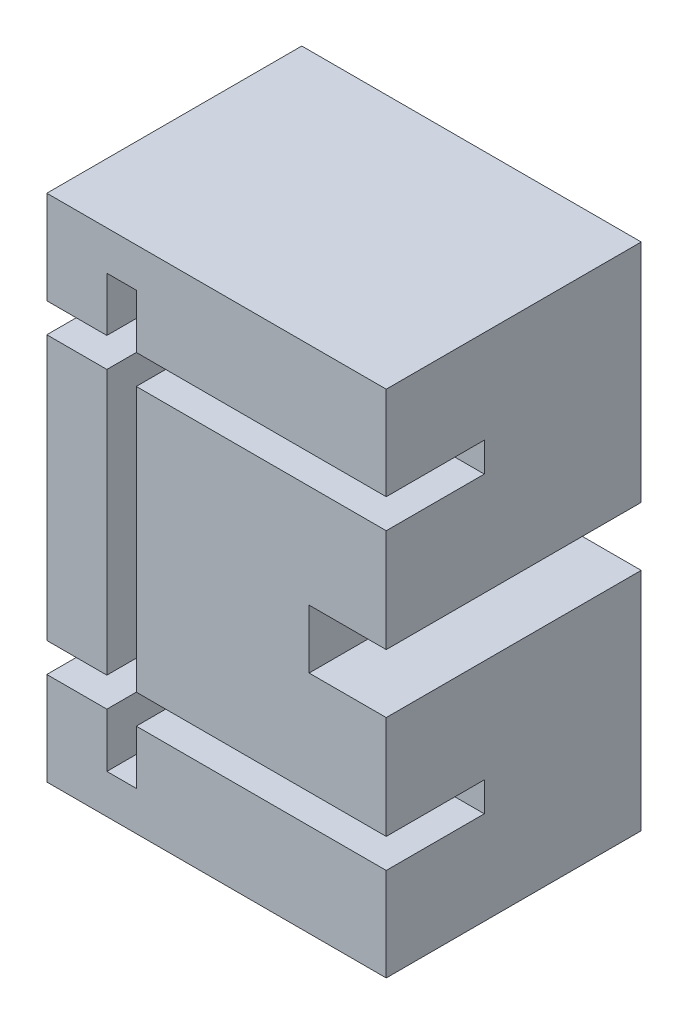
from build123d import *

# Parameters (mm, degrees)
BOSS_EXTRUDE1_DEPTH = 13
SKETCH2_W           = 12.743753884
SKETCH2_H           = 1.5
SKETCH2_W_2         = 1.5
SKETCH2_H_2         = 2.75
SKETCH2_W_3         = 3.0625
SKETCH2_H_3         = 13.5
CUT_EXTRUDE1_DEPTH  = 5


with BuildPart() as part:
    # Sketch1 → Boss-Extrude1 (new body)
    with BuildSketch(Plane.XY):
        Polygon((10.243753884, 1.5), (10.243753884, 13), (8.5625, 13), (7.0625, 13), (-7.0625, 13), (-7.0625, -13), (7.0625, -13), (8.5625, -13), (10.243753884, -13), (10.243753884, -1.5), (9.3125, -1.5), (6.3125, -1.5), (6.3125, 1.5), (9.3125, 1.5), align=None)
    extrude(amount=BOSS_EXTRUDE1_DEPTH)

    # Sketch2 → Cut-Extrude1 (cut)
    with BuildSketch(Plane.XY.offset(13)):
        with Locations((3.871876942, 7.5)):
            Rectangle(SKETCH2_W, SKETCH2_H)
        with Locations((-3.25, 9.625)):
            Rectangle(SKETCH2_W_2, SKETCH2_H_2)
        with Locations((-5.53125, 7.5)):
            Rectangle(SKETCH2_W_3, SKETCH2_H)
        with Locations((-3.25, 7.5)):
            Rectangle(SKETCH2_W_2, SKETCH2_H)
        with Locations((-3.25, 0)):
            Rectangle(SKETCH2_W_2, SKETCH2_H_3)
        with Locations((-3.25, -9.625)):
            Rectangle(SKETCH2_W_2, SKETCH2_H_2)
        with Locations((-3.25, -7.5)):
            Rectangle(SKETCH2_W_2, SKETCH2_H)
        with Locations((-5.53125, -7.5)):
            Rectangle(SKETCH2_W_3, SKETCH2_H)
        with Locations((3.871876942, -7.5)):
            Rectangle(SKETCH2_W, SKETCH2_H)
    extrude(amount=-CUT_EXTRUDE1_DEPTH, mode=Mode.SUBTRACT)


solid = part.part
